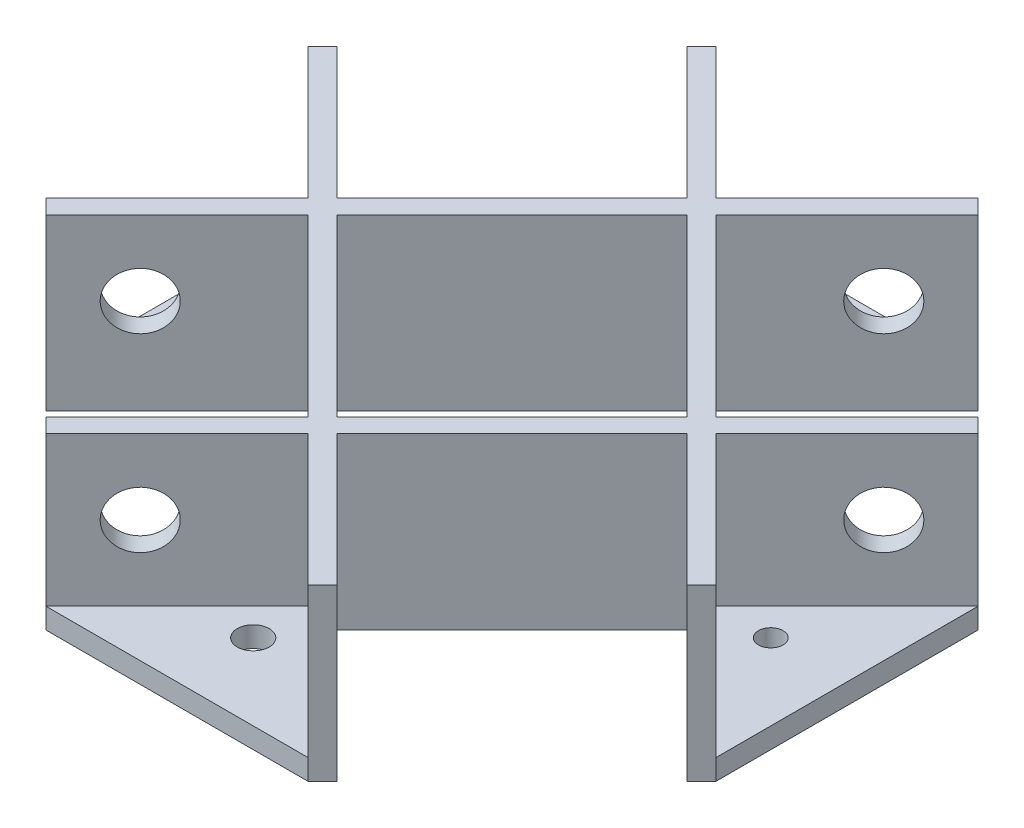
from build123d import *

# Parameters (mm, degrees)
GENERAL_SHAPE_DEPTH             = 2
RETAINING_WALLS_DEPTH           = 14.5
EXTERIOR_MOUNTING_EDGE_DEPTH    = 2
REAR_WALL_DEPTH                 = 14.5
CUT_EXTRUDE2_DEPTH              = 51.801082666
CUT_EXTRUDE2_DEPTH_BACK         = 51.801082666
SKETCH35_R                      = 2.75
CIRPATTERN2_COUNT               = 4
EXTERIOR_MOUNTING_HOLE_D        = 2.4
SHOULDER_SCREW_MOUNTING_HOLES_D = 3.1
CUT_EXTRUDE1_REACH              = 50.195


with BuildPart() as part:
    # Sketch3 → General shape (new body)
    with BuildSketch(Plane(origin=(0, 0, 0), x_dir=(1, 0, 0), z_dir=(0, 1, 0))):
        Polygon((-32.5, -12.701010127), (-12.701010127, -32.5), (0, -19.798989873), (0, 0), (-19.798989873, 0), align=None)
    extrude(amount=GENERAL_SHAPE_DEPTH)

    # Sketch4 → Retaining walls (add)
    with BuildSketch(Plane(origin=(0, 2, 0), x_dir=(1, 0, 0), z_dir=(0, 1, 0))):
        Polygon((-19.798989873, 0), (-32.5, -12.701010127), (-31.085786438, -14.115223689), (-16.970562748, 0), align=None)
        Polygon((-14.115223689, -31.085786438), (0, -16.970562748), (0, -19.798989873), (-12.701010127, -32.5), align=None)
    extrude(amount=RETAINING_WALLS_DEPTH)

    # Sketch14 → Exterior mounting edge (add)
    with BuildSketch(Plane.XZ):
        Polygon((-19.798989873, 0), (-32.5, 12.701010127), (-32.5, 0), align=None)
        Polygon((0, 19.798989873), (0, 32.5), (-12.701010127, 32.5), align=None)
    extrude(amount=-EXTERIOR_MOUNTING_EDGE_DEPTH)

    # Sketch18 → Rear wall (add)
    with BuildSketch(Plane(origin=(0, 2, 0), x_dir=(1, 0, 0), z_dir=(0, 1, 0))):
        Polygon((-16.970562748, 0), (0, -16.970562748), (-1.414213562, -18.384776311), (-18.384776311, -1.414213562), align=None)
    extrude(amount=REAR_WALL_DEPTH)

    # Sketch35 → Cut-Extrude2 (cut, two sides: drawn at the far end of the back side and taken through both)
    with BuildSketch(Plane(origin=(-9.899494937, 0, -9.899494937), x_dir=(-0.7071067811865475, 0, 0.7071067811865477), z_dir=(-0.7071067811865477, 0, -0.7071067811865475)).offset(-CUT_EXTRUDE2_DEPTH_BACK)):
        with Locations((25.5, 9.25)):
            Circle(SKETCH35_R)
    extrude(amount=CUT_EXTRUDE2_DEPTH + CUT_EXTRUDE2_DEPTH_BACK, mode=Mode.SUBTRACT)


with BuildPart() as cirpattern2_1:
    # CirPattern2: pattern copy
    add(part.part.rotate(Axis((0, 0, 0), (0, 1, 0)), 1 * 360 / CIRPATTERN2_COUNT))


with BuildPart() as cirpattern2_2:
    # CirPattern2: pattern copy
    add(part.part.rotate(Axis((0, 0, 0), (0, 1, 0)), 2 * 360 / CIRPATTERN2_COUNT))


with BuildPart() as cirpattern2_3:
    # CirPattern2: pattern copy
    add(part.part.rotate(Axis((0, 0, 0), (0, 1, 0)), 3 * 360 / CIRPATTERN2_COUNT))

    # Combine1: union CirPattern2_1, CirPattern2_2, part
    add(cirpattern2_1.part)
    add(cirpattern2_2.part)
    add(part.part)

    # Exterior mounting hole (through all)
    with Locations(Plane(origin=(0, 2, 0), x_dir=(1, 0, 0), z_dir=(0, 1, 0))):
        with Locations((-25.1, 0), (25.1, 0)):
            Hole(EXTERIOR_MOUNTING_HOLE_D / 2)

    # Shoulder screw mounting holes (through all)
    with Locations(Plane(origin=(0, 2, 0), x_dir=(1, 0, 0), z_dir=(0, 1, 0))):
        with Locations((0, -25.1), (0, 25.1)):
            Hole(SHOULDER_SCREW_MOUNTING_HOLES_D / 2)

    # Sketch23 → Cut-Extrude1 (cut, up to next)
    with BuildSketch(Plane(origin=(0, 2, 0), x_dir=(1, 0, 0), z_dir=(0, 1, 0)), mode=Mode.PRIVATE) as cut_extrude1_sk1:
        Polygon((0, 16.970562748), (-16.970562748, 0), (0, -16.970562748), (16.970562748, 0), align=None)
    cut_extrude1_tool1 = extrude(cut_extrude1_sk1.sketch, amount=-CUT_EXTRUDE1_REACH, mode=Mode.PRIVATE) & cirpattern2_3.part
    # Sketch23 → Cut-Extrude1 (cut, up to next)
    with BuildSketch(Plane(origin=(0, 2, 0), x_dir=(1, 0, 0), z_dir=(0, 1, 0)), mode=Mode.PRIVATE) as cut_extrude1_sk2:
        Polygon((31.085786438, 14.115223689), (18.384776311, 1.414213562), (1.414213562, 18.384776311), (14.115223689, 31.085786438), align=None)
    cut_extrude1_tool2 = extrude(cut_extrude1_sk2.sketch, amount=-CUT_EXTRUDE1_REACH, mode=Mode.PRIVATE) & cirpattern2_3.part
    # Sketch23 → Cut-Extrude1 (cut, up to next)
    with BuildSketch(Plane(origin=(0, 2, 0), x_dir=(1, 0, 0), z_dir=(0, 1, 0)), mode=Mode.PRIVATE) as cut_extrude1_sk3:
        Polygon((-18.384776311, 1.414213562), (-31.085786438, 14.115223689), (-14.115223689, 31.085786438), (-1.414213562, 18.384776311), align=None)
    cut_extrude1_tool3 = extrude(cut_extrude1_sk3.sketch, amount=-CUT_EXTRUDE1_REACH, mode=Mode.PRIVATE) & cirpattern2_3.part
    # Sketch23 → Cut-Extrude1 (cut, up to next)
    with BuildSketch(Plane(origin=(0, 2, 0), x_dir=(1, 0, 0), z_dir=(0, 1, 0)), mode=Mode.PRIVATE) as cut_extrude1_sk4:
        Polygon((-1.414213562, -18.384776311), (-14.115223689, -31.085786438), (-31.085786438, -14.115223689), (-18.384776311, -1.414213562), align=None)
    cut_extrude1_tool4 = extrude(cut_extrude1_sk4.sketch, amount=-CUT_EXTRUDE1_REACH, mode=Mode.PRIVATE) & cirpattern2_3.part
    # Sketch23 → Cut-Extrude1 (cut, up to next)
    with BuildSketch(Plane(origin=(0, 2, 0), x_dir=(1, 0, 0), z_dir=(0, 1, 0)), mode=Mode.PRIVATE) as cut_extrude1_sk5:
        Polygon((14.115223689, -31.085786438), (1.414213562, -18.384776311), (18.384776311, -1.414213562), (31.085786438, -14.115223689), align=None)
    cut_extrude1_tool5 = extrude(cut_extrude1_sk5.sketch, amount=-CUT_EXTRUDE1_REACH, mode=Mode.PRIVATE) & cirpattern2_3.part
    add(cut_extrude1_tool1.solids().sort_by_distance((0, 2, 0))[0], mode=Mode.SUBTRACT)
    add(cut_extrude1_tool2.solids().sort_by_distance((16.25, 2, -16.25))[0], mode=Mode.SUBTRACT)
    add(cut_extrude1_tool3.solids().sort_by_distance((-16.25, 2, -16.25))[0], mode=Mode.SUBTRACT)
    add(cut_extrude1_tool4.solids().sort_by_distance((-16.25, 2, 16.25))[0], mode=Mode.SUBTRACT)
    add(cut_extrude1_tool5.solids().sort_by_distance((16.25, 2, 16.25))[0], mode=Mode.SUBTRACT)


solid = cirpattern2_3.part
